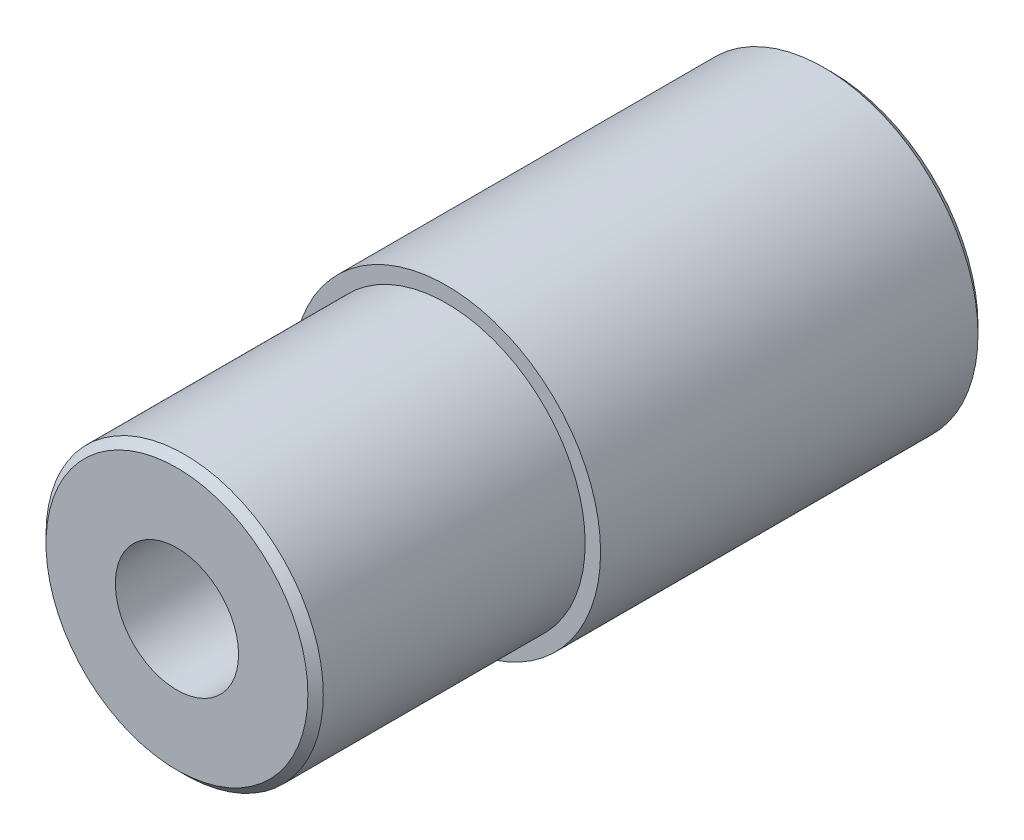
from build123d import *

# Parameters (mm, degrees)
CROQUIS1_R              = 20
SALIENTE_EXTRUIR1_DEPTH = 50
CROQUIS2_R              = 18
SALIENTE_EXTRUIR2_DEPTH = 35
CROQUIS3_R              = 12.5
CORTAR_EXTRUIR1_DEPTH   = 28
CORTAR_EXTRUIR2_REACH   = 91.582
CROQUIS4_R              = 8
CHAFL_N1_SIZE           = 1


with BuildPart() as part:
    # Croquis1 → Saliente-Extruir1 (new body)
    with BuildSketch(Plane.XY):
        Circle(CROQUIS1_R)
    extrude(amount=SALIENTE_EXTRUIR1_DEPTH)

    # Croquis2 → Saliente-Extruir2 (add)
    with BuildSketch(Plane.XY.offset(50)):
        Circle(CROQUIS2_R)
    extrude(amount=SALIENTE_EXTRUIR2_DEPTH)

    # Croquis3 → Cortar-Extruir1 (cut)
    with BuildSketch(Plane(origin=(0, 0, 0), x_dir=(-1, 0, 0), z_dir=(0, 0, -1))):
        Circle(CROQUIS3_R)
    extrude(amount=-CORTAR_EXTRUIR1_DEPTH, mode=Mode.SUBTRACT)

    # Croquis4 → Cortar-Extruir2 (cut, up to next)
    with BuildSketch(Plane.XY.offset(85), mode=Mode.PRIVATE) as cortar_extruir2_sk1:
        Circle(CROQUIS4_R)
    cortar_extruir2_tool1 = extrude(cortar_extruir2_sk1.sketch, amount=-CORTAR_EXTRUIR2_REACH, mode=Mode.PRIVATE) & part.part
    add(cortar_extruir2_tool1.solids().sort_by_distance((0, 0, 85))[0], mode=Mode.SUBTRACT)

    # Chaflán1
    chafl_n1_edges = [part.edges().sort_by_distance(p)[0] for p in [
        (-20, 0, 0),
        (-18, 0, 85),
    ]]
    chamfer(chafl_n1_edges, length=CHAFL_N1_SIZE)


solid = part.part
